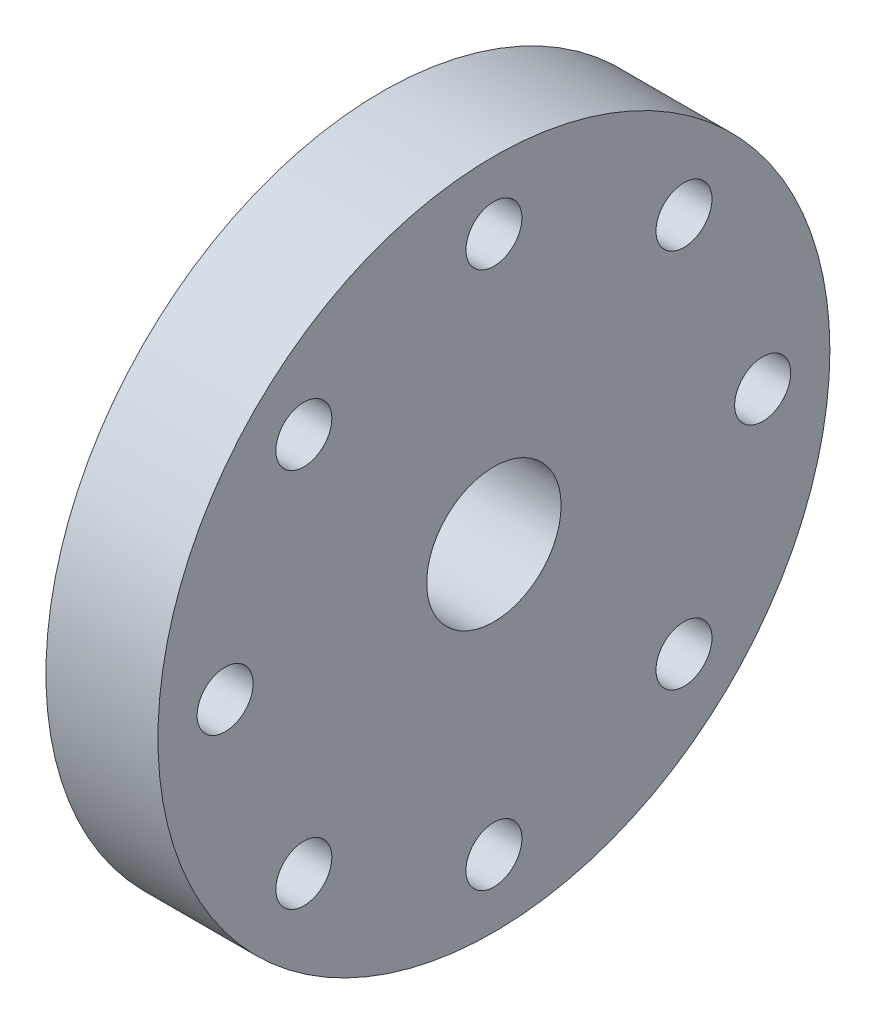
from build123d import *

# Parameters (mm, degrees)
SKETCH_1_R               = 15
SKETCH_1_R_2             = 1.25
EXTRUDE_2_DEPTH          = 5
SKETCH_3_R               = 5
EXTRUDE_4_DEPTH          = 1
SKETCH_4_R               = 3
CUT_EXTRUDE_1_DEPTH      = 5.5
CUT_EXTRUDE_2_DEPTH      = 78
CUT_EXTRUDE_2_DEPTH_BACK = 5.5
SKETCH_5_R               = 1.5


with BuildPart() as part:
    # ｽｹｯﾁ1 → ﾎﾞｽ - 押し出し2 (new body)
    with BuildSketch(Plane(origin=(0, 0, 0), x_dir=(0, 0, -1), z_dir=(1, 0, 0))):
        with Locations((27.213776389, 17.709467549)):
            Circle(SKETCH_1_R)
        with Locations((27.213776389, 29.709467549)):
            Circle(SKETCH_1_R_2, mode=Mode.SUBTRACT)
        with Locations((35.699057763, 26.194748924)):
            Circle(SKETCH_1_R_2, mode=Mode.SUBTRACT)
        with Locations((18.728495014, 26.194748924)):
            Circle(SKETCH_1_R_2, mode=Mode.SUBTRACT)
        with Locations((15.213776389, 17.709467549)):
            Circle(SKETCH_1_R_2, mode=Mode.SUBTRACT)
        with Locations((35.699057763, 9.224186175)):
            Circle(SKETCH_1_R_2, mode=Mode.SUBTRACT)
        with Locations((39.213776389, 17.709467549)):
            Circle(SKETCH_1_R_2, mode=Mode.SUBTRACT)
        with Locations((18.728495014, 9.224186175)):
            Circle(SKETCH_1_R_2, mode=Mode.SUBTRACT)
        with Locations((27.213776389, 5.709467549)):
            Circle(SKETCH_1_R_2, mode=Mode.SUBTRACT)
    extrude(amount=EXTRUDE_2_DEPTH)

    # ｽｹｯﾁ3 → ﾎﾞｽ - 押し出し4 (add)
    with BuildSketch(Plane(origin=(0, 0, 0), x_dir=(0, 0, -1), z_dir=(1, 0, 0))):
        with Locations((27.213776389, 17.709467549)):
            Circle(SKETCH_3_R)
    extrude(amount=-EXTRUDE_4_DEPTH)

    # ｽｹｯﾁ4 → ｶｯﾄ - 押し出し1 (cut)
    with BuildSketch(Plane(origin=(5, 0, 0), x_dir=(0, 0, -1), z_dir=(1, 0, 0))):
        with Locations((27.213776389, 17.709467549)):
            Circle(SKETCH_4_R)
    extrude(amount=-CUT_EXTRUDE_1_DEPTH, mode=Mode.SUBTRACT)

    # ｽｹｯﾁ5 → ｶｯﾄ - 押し出し2 (cut, two sides: drawn at the far end of the back side and taken through both)
    with BuildSketch(Plane.ZY.offset(-CUT_EXTRUDE_2_DEPTH_BACK)):
        with Locations(Location((-27.213776389, 17.709467549, 0), (0, 0, 180))):
            Circle(SKETCH_5_R)
    extrude(amount=CUT_EXTRUDE_2_DEPTH + CUT_EXTRUDE_2_DEPTH_BACK, mode=Mode.SUBTRACT)


solid = part.part
